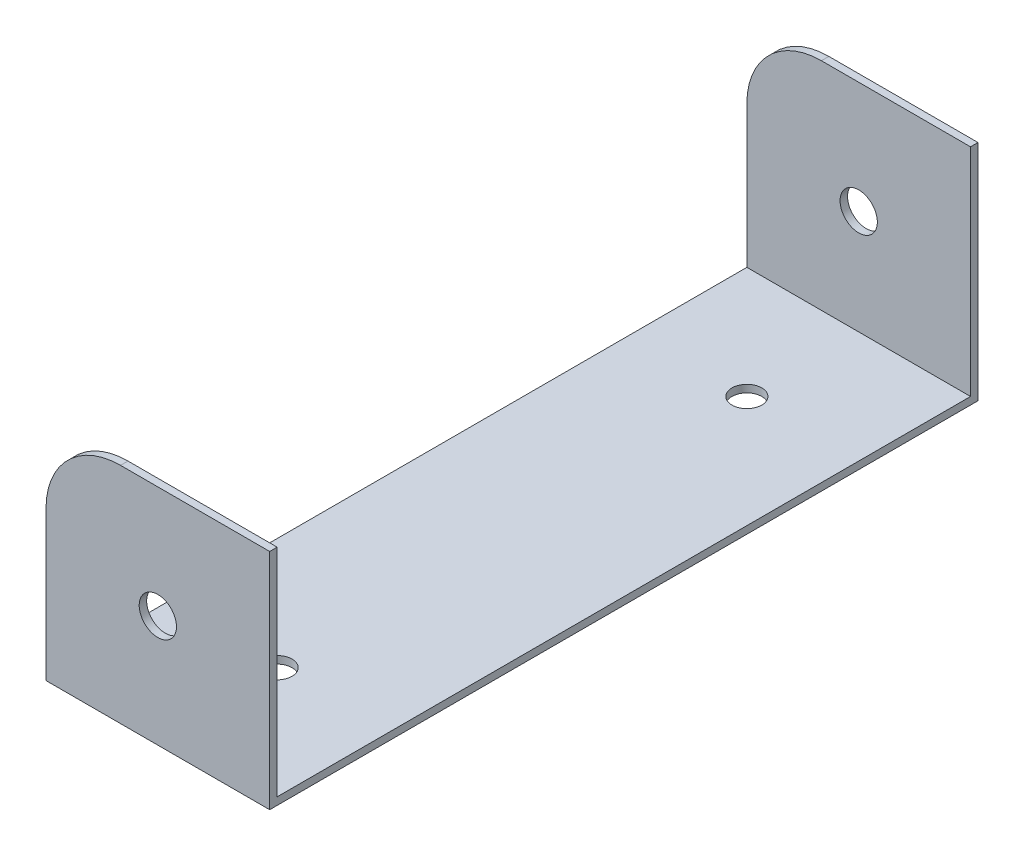
from build123d import *

# Parameters (mm, degrees)
CROQUIS2_W              = 30
CROQUIS2_H              = 95
SALIENTE_EXTRUIR1_DEPTH = 1
CROQUIS5_W              = 30
CROQUIS5_H              = 29
SALIENTE_EXTRUIR2_DEPTH = 1
CROQUIS6_W              = 30
CROQUIS6_H              = 29
SALIENTE_EXTRUIR3_DEPTH = 1
CROQUIS7_R              = 2.5
CORTAR_EXTRUIR1_DEPTH   = 1
CORTAR_EXTRUIR2_START   = -1
CROQUIS8_R              = 2.5
CORTAR_EXTRUIR2_DEPTH   = 1
REDONDEO1_R             = 10
CROQUIS9_R              = 2
CORTAR_EXTRUIR3_DEPTH   = 1


with BuildPart() as part:
    # Croquis2 → Saliente-Extruir1 (new body)
    with BuildSketch(Plane(origin=(0, 0, 0), x_dir=(1, 0, 0), z_dir=(0, 1, 0))):
        Rectangle(CROQUIS2_W, CROQUIS2_H)
    extrude(amount=SALIENTE_EXTRUIR1_DEPTH)

    # Croquis5 → Saliente-Extruir2 (add)
    with BuildSketch(Plane.XY.offset(47.5)):
        with Locations((0, 15.5)):
            Rectangle(CROQUIS5_W, CROQUIS5_H)
    extrude(amount=-SALIENTE_EXTRUIR2_DEPTH)

    # Croquis6 → Saliente-Extruir3 (add)
    with BuildSketch(Plane(origin=(0, 0, -47.5), x_dir=(-1, 0, 0), z_dir=(0, 0, -1))):
        with Locations((0, 15.5)):
            Rectangle(CROQUIS6_W, CROQUIS6_H)
    extrude(amount=-SALIENTE_EXTRUIR3_DEPTH)

    # Croquis7 → Cortar-Extruir1 (cut)
    with BuildSketch(Plane(origin=(0, 0, -47.5), x_dir=(-1, 0, 0), z_dir=(0, 0, -1))):
        with Locations((0, 15)):
            Circle(CROQUIS7_R)
    extrude(amount=-CORTAR_EXTRUIR1_DEPTH, mode=Mode.SUBTRACT)

    # Croquis8 → Cortar-Extruir2 (cut)
    with BuildSketch(Plane.XY.offset(47.5).offset(CORTAR_EXTRUIR2_START)):
        with Locations(Location((0, 15, 0), (0, 0, 180))):
            Circle(CROQUIS8_R)
    extrude(amount=CORTAR_EXTRUIR2_DEPTH, mode=Mode.SUBTRACT)

    # Redondeo1
    redondeo1_edges = [part.edges().sort_by_distance(p)[0] for p in [
        (-15, 30, 47),
        (-15, 30, -47),
    ]]
    fillet(redondeo1_edges, radius=REDONDEO1_R)

    # Croquis9 → Cortar-Extruir3 (cut)
    with BuildSketch(Plane(origin=(0, 1, 0), x_dir=(1, 0, 0), z_dir=(0, 1, 0))):
        with Locations(Location((0, 31.5, 0), (0, 0, 270))):
            Circle(CROQUIS9_R)
        with Locations(Location((0, -31.5, 0), (0, 0, 90))):
            Circle(CROQUIS9_R)
    extrude(amount=-CORTAR_EXTRUIR3_DEPTH, mode=Mode.SUBTRACT)


solid = part.part
